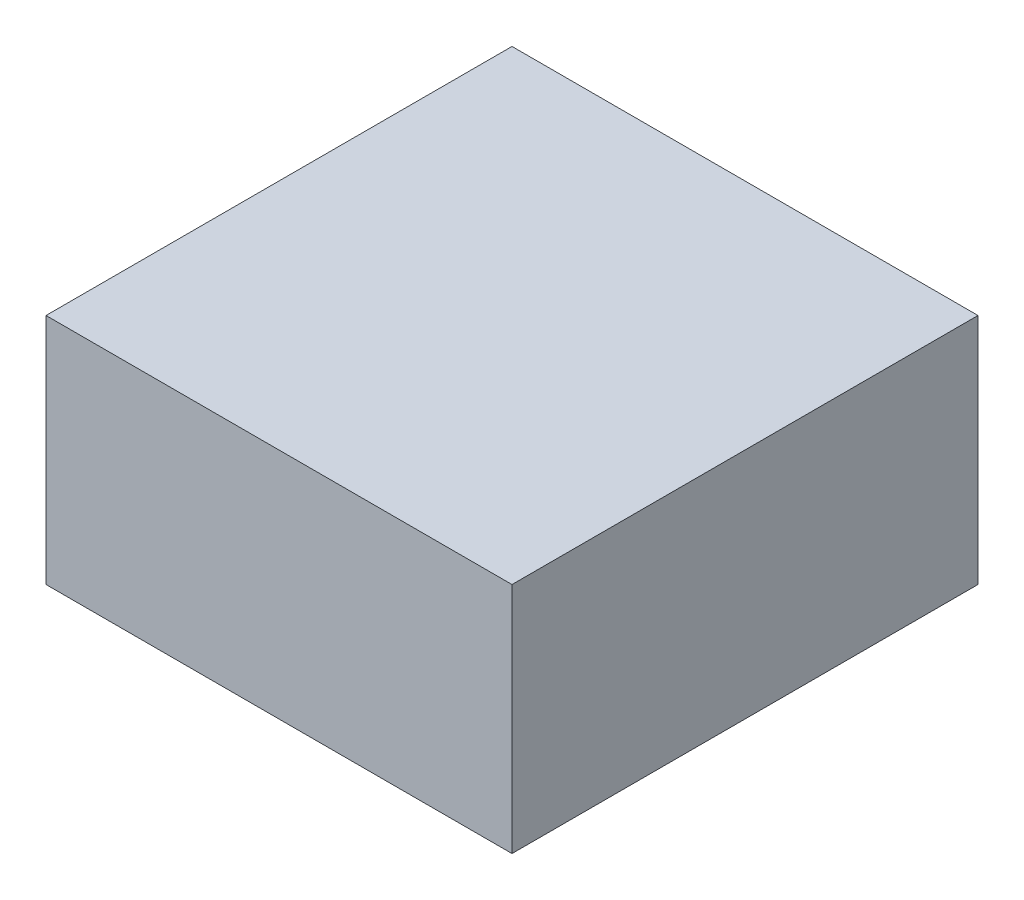
from build123d import *

# Parameters (mm, degrees)
SKETCH_1_W      = 30
SKETCH_1_H      = 30
EXTRUDE_1_DEPTH = 15


with BuildPart() as part:
    # 草图1 → 凸台-拉伸1 (new body)
    with BuildSketch(Plane(origin=(0, 0, 0), x_dir=(1, 0, 0), z_dir=(0, 1, 0))):
        Rectangle(SKETCH_1_W, SKETCH_1_H)
    extrude(amount=EXTRUDE_1_DEPTH)


solid = part.part
